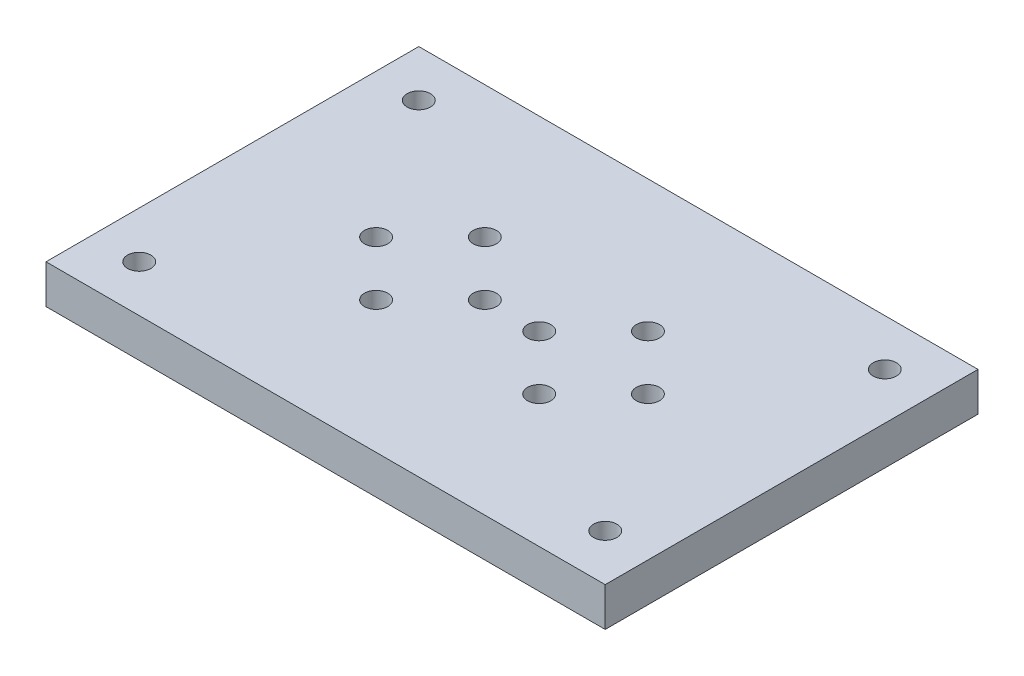
from build123d import *

# Parameters (mm, degrees)
SKETCH1_W           = 72
SKETCH1_H           = 48
SKETCH1_R           = 1.5
BOSS_EXTRUDE1_DEPTH = 5


with BuildPart() as part:
    # Sketch1 → Boss-Extrude1 (new body)
    with BuildSketch(Plane(origin=(0, 0, 0), x_dir=(1, 0, 0), z_dir=(0, 1, 0))):
        Rectangle(SKETCH1_W, SKETCH1_H)
        with Locations(Location((-17.5, 0, 0), (0, 0, 270))):
            Circle(SKETCH1_R, mode=Mode.SUBTRACT)
        with Locations(Location((-10.5, 7, 0), (0, 0, 270))):
            Circle(SKETCH1_R, mode=Mode.SUBTRACT)
        with Locations(Location((-3.5, 0, 0), (0, 0, 270))):
            Circle(SKETCH1_R, mode=Mode.SUBTRACT)
        with Locations(Location((-10.5, -7, 0), (0, 0, 270))):
            Circle(SKETCH1_R, mode=Mode.SUBTRACT)
        with Locations(Location((-30, 18, 0), (0, 0, 270))):
            Circle(SKETCH1_R, mode=Mode.SUBTRACT)
        with Locations(Location((-30, -18, 0), (0, 0, 270))):
            Circle(SKETCH1_R, mode=Mode.SUBTRACT)
        with Locations(Location((10.5, 7, 0), (0, 0, 90))):
            Circle(SKETCH1_R, mode=Mode.SUBTRACT)
        with Locations(Location((3.5, 0, 0), (0, 0, 90))):
            Circle(SKETCH1_R, mode=Mode.SUBTRACT)
        with Locations(Location((10.5, -7, 0), (0, 0, 90))):
            Circle(SKETCH1_R, mode=Mode.SUBTRACT)
        with Locations(Location((17.5, 0, 0), (0, 0, 90))):
            Circle(SKETCH1_R, mode=Mode.SUBTRACT)
        with Locations(Location((30, 18, 0), (0, 0, 90))):
            Circle(SKETCH1_R, mode=Mode.SUBTRACT)
        with Locations(Location((30, -18, 0), (0, 0, 90))):
            Circle(SKETCH1_R, mode=Mode.SUBTRACT)
    extrude(amount=BOSS_EXTRUDE1_DEPTH)


solid = part.part
